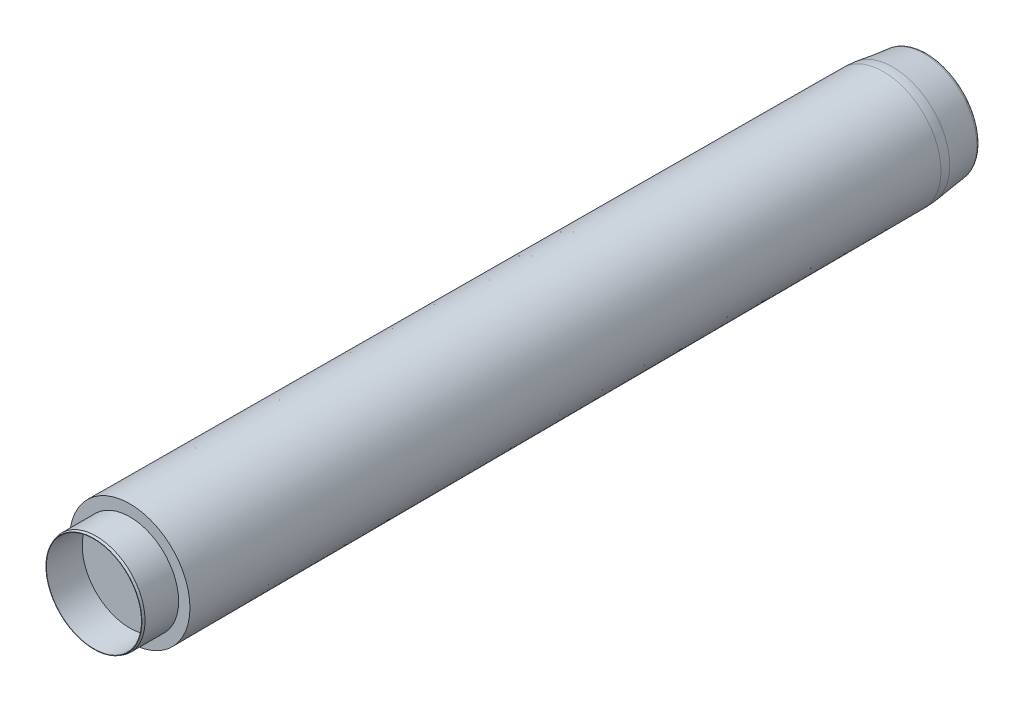
from build123d import *

# Parameters (mm, degrees)
SKETCH1_R           = 7.7
BOSS_EXTRUDE3_DEPTH = 102.14
BOSS_EXTRUDE3_DRAFT = -0.2
SKETCH3_R           = 6.25
SKETCH3_R_2         = 6.1
BOSS_EXTRUDE4_DEPTH = 4.6
CHAMFER1_SIZE       = 0.6
CHAMFER1_SIZE2      = 5
FILLET1_R           = 0.5
FILLET2_R           = 10
CHAMFER2_SIZE       = 0.3
CHAMFER2_SIZE2      = 0.1


with BuildPart() as part:
    # Sketch1 → Boss-Extrude3 (with draft: the straight prism first)
    with BuildSketch(Plane.XY):
        Circle(SKETCH1_R)
    extrude(amount=-BOSS_EXTRUDE3_DEPTH)
    # Boss-Extrude3: the draft: its side faces are tilted about the plane it starts from
    boss_extrude3_sides = [part.faces().sort_by_distance(p)[0] for p in [
        (-7.7, 0, -51.07),
    ]]
    draft(boss_extrude3_sides, Plane.XY, BOSS_EXTRUDE3_DRAFT)

    # Sketch3 → Boss-Extrude4 (add)
    with BuildSketch(Plane.XY):
        Circle(SKETCH3_R)
        Circle(SKETCH3_R_2, mode=Mode.SUBTRACT)
    extrude(amount=BOSS_EXTRUDE4_DEPTH)

    # Chamfer1
    chamfer1_edges = [part.edges().sort_by_distance(p)[0] for p in [
        (-7.343462692, 0, -102.14),
    ]]
    chamfer1_side = [part.faces().sort_by_distance(p)[0] for p in [
        (0, 0, -102.14),
    ]]
    chamfer(chamfer1_edges, length=CHAMFER1_SIZE, length2=CHAMFER1_SIZE2, reference=chamfer1_side[0])

    # Fillet1
    fillet1_edges = [part.edges().sort_by_distance(p)[0] for p in [
        (-6.743462692, 0, -102.14),
    ]]
    fillet(fillet1_edges, radius=FILLET1_R)

    # Fillet2
    fillet2_edges = [part.edges().sort_by_distance(p)[0] for p in [
        (-7.360915949, 0, -97.140030462),
    ]]
    fillet(fillet2_edges, radius=FILLET2_R)

    # Chamfer2
    chamfer2_edges = [part.edges().sort_by_distance(p)[0] for p in [
        (-6.25, 0, 4.6),
    ]]
    chamfer2_side = [part.faces().sort_by_distance(p)[0] for p in [
        (-6.25, 0, 2.3),
    ]]
    chamfer(chamfer2_edges, length=CHAMFER2_SIZE, length2=CHAMFER2_SIZE2, reference=chamfer2_side[0])


solid = part.part
